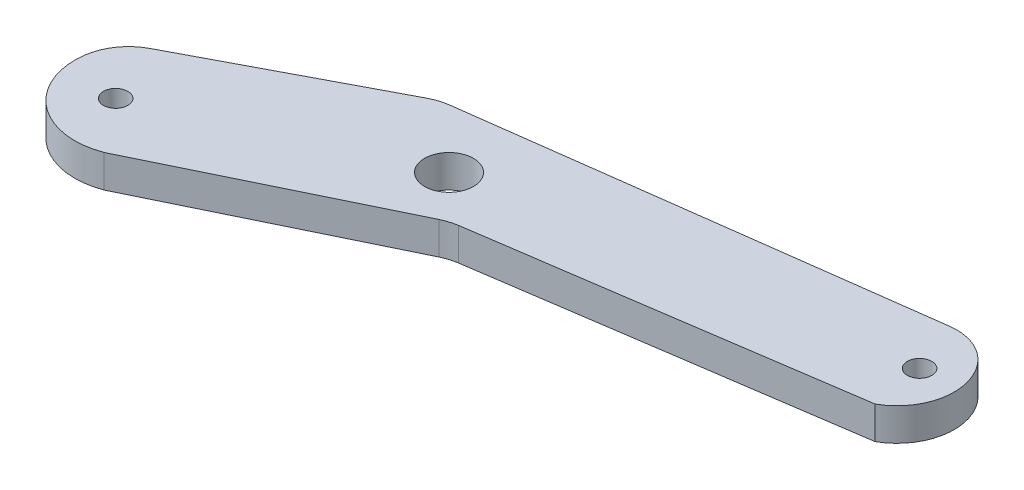
from build123d import *

# Parameters (mm, degrees)
CROQUIS1_R              = 2.38125
CROQUIS1_R_2            = 4.7625
SALIENTE_EXTRUIR1_DEPTH = 6.35


with BuildPart() as part:
    # Croquis1 → Saliente-Extruir1 (new body)
    with BuildSketch(Plane(origin=(0, 0, 0), x_dir=(1, 0, 0), z_dir=(0, 1, 0))):
        with BuildLine():
            Line((103.955940895, 6.200359073), (33.182720339, -4.250520887))
            ThreePointArc((33.182720339, -4.250520887), (31.696731466, -4.587290217), (30.279155254, -5.145908331))
            Line((30.279155254, -5.145908331), (-13.707132326, -26.482618703))
            ThreePointArc((-13.707132326, -26.482618703), (-26.984336102, -24.417368961), (-32.012638404, -11.956808276))
            ThreePointArc((-32.012638404, -11.956808276), (-30.297252372, -7.553267867), (-26.751302562, -4.429174828))
            Line((-26.751302562, -4.429174828), (8.61159414, 14.14717195))
            ThreePointArc((8.61159414, 14.14717195), (10.234533943, 14.825001148), (11.951126741, 15.208009235))
            Line((11.951126741, 15.208009235), (98.089879586, 26.598503543))
            ThreePointArc((98.089879586, 26.598503543), (103.154358957, 25.953614792), (107.240482188, 22.892825721))
            ThreePointArc((107.240482188, 22.892825721), (109.446452134, 13.78938225), (103.955940895, 6.200359073))
        make_face()
        with Locations(Location((102.277188424, 16.565289857, 0), (0, 0, 270))):
            Circle(CROQUIS1_R, mode=Mode.SUBTRACT)
        with Locations(Location((23.306287218, 3.774794841, 0), (0, 0, 270))):
            Circle(CROQUIS1_R_2, mode=Mode.SUBTRACT)
        with Locations(Location((-21.693712782, -16.225205159, 0), (0, 0, 270))):
            Circle(CROQUIS1_R, mode=Mode.SUBTRACT)
    extrude(amount=SALIENTE_EXTRUIR1_DEPTH)


solid = part.part
